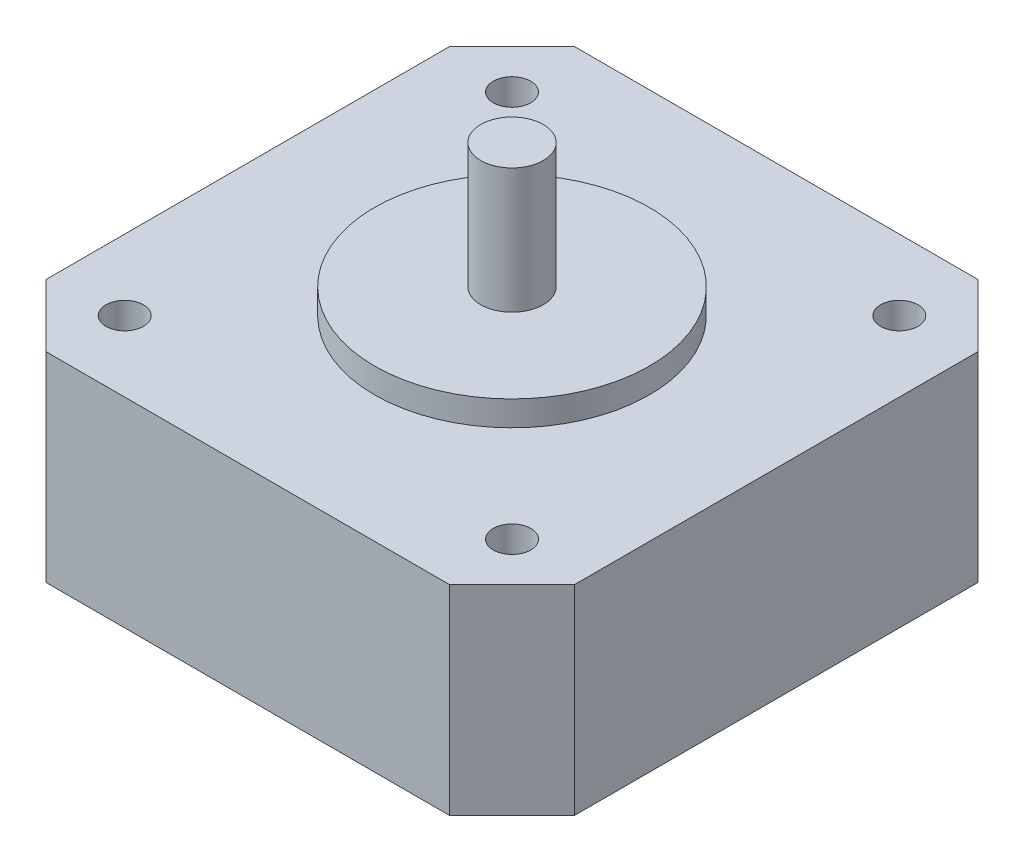
from build123d import *

# Parameters (mm, degrees)
SKETCH_1_W          = 42.3
SKETCH_1_H          = 42.3
EXTRUDE_1_DEPTH     = 16
CHAMFER_1_SIZE      = 5
SKETCH_2_R          = 11
EXTRUDE_2_DEPTH     = 2
SKETCH_3_R          = 1.5
CUT_EXTRUDE_1_DEPTH = 5
SKETCH_4_R          = 2.5
EXTRUDE_3_DEPTH     = 10


with BuildPart() as part:
    # 草图1 → 凸台-拉伸1 (new body)
    with BuildSketch(Plane.XZ.offset(61.9)):
        Rectangle(SKETCH_1_W, SKETCH_1_H)
    extrude(amount=-EXTRUDE_1_DEPTH)

    # 倒角1
    chamfer_1_edges = [part.edges().sort_by_distance(p)[0] for p in [
        (-21.15, -53.9, -21.15),
        (-21.15, -53.9, 21.15),
        (21.15, -53.9, 21.15),
        (21.15, -53.9, -21.15),
    ]]
    chamfer(chamfer_1_edges, length=CHAMFER_1_SIZE)

    # 草图2 → 凸台-拉伸2 (add)
    with BuildSketch(Plane(origin=(0, -45.9, 0), x_dir=(-1, 0, 0), z_dir=(0, 1, 0))):
        with Locations(Location((0, 0, 0), (0, 0, 90))):
            Circle(SKETCH_2_R)
    extrude(amount=EXTRUDE_2_DEPTH)

    # 草图3 → 切除-拉伸1 (cut)
    with BuildSketch(Plane(origin=(0, -45.9, 0), x_dir=(1, 0, 0), z_dir=(0, 1, 0))):
        with Locations(Location((-15.5, 15.5, 0), (0, 0, 270))):
            Circle(SKETCH_3_R)
        with Locations(Location((15.5, 15.5, 0), (0, 0, 270))):
            Circle(SKETCH_3_R)
        with Locations(Location((15.5, -15.5, 0), (0, 0, 270))):
            Circle(SKETCH_3_R)
        with Locations(Location((-15.5, -15.5, 0), (0, 0, 270))):
            Circle(SKETCH_3_R)
    extrude(amount=-CUT_EXTRUDE_1_DEPTH, mode=Mode.SUBTRACT)

    # 草图4 → 凸台-拉伸3 (add)
    with BuildSketch(Plane(origin=(0, -43.9, 0), x_dir=(1, 0, 0), z_dir=(0, 1, 0))):
        with Locations(Location((0, 0, 0), (0, 0, 270))):
            Circle(SKETCH_4_R)
    extrude(amount=EXTRUDE_3_DEPTH)


solid = part.part
